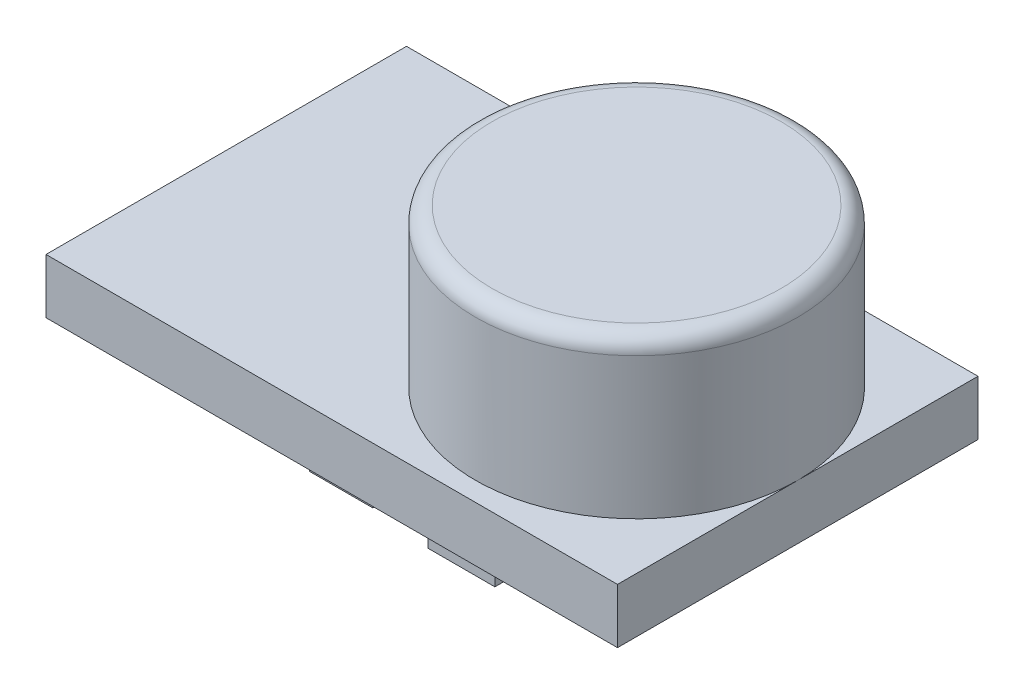
from build123d import *

# Parameters (mm, degrees)
SKETCH1_W           = 17.2
SKETCH1_H           = 10.85
BOSS_EXTRUDE1_DEPTH = 1.65
SKETCH2_R           = 4.85
BOSS_EXTRUDE2_DEPTH = 4.75
FILLET1_R           = 0.5
SKETCH3_W           = 1.359488803
SKETCH3_H           = 3.031292602
SKETCH3_W_2         = 1.800404091
SKETCH3_H_2         = 0.955316456
SKETCH3_W_3         = 0.863459105
SKETCH3_H_3         = 1.72691821
SKETCH3_W_4         = 0.918573516
SKETCH3_W_5         = 1.910632913
SKETCH3_H_4         = 0.936944986
SKETCH3_H_5         = 0.973687927
SKETCH3_W_6         = 2.020861734
SKETCH3_W_7         = 0.936944986
SKETCH3_H_6         = 2.112719086
SKETCH3_W_8         = 1.855518501
SKETCH3_H_7         = 0.992059397
BOSS_EXTRUDE3_DEPTH = 1


with BuildPart() as part:
    # Sketch1 → Boss-Extrude1 (new body)
    with BuildSketch(Plane(origin=(0, 0, 0), x_dir=(1, 0, 0), z_dir=(0, 1, 0))):
        Rectangle(SKETCH1_W, SKETCH1_H)
    extrude(amount=BOSS_EXTRUDE1_DEPTH)

    # Sketch2 → Boss-Extrude2 (add)
    with BuildSketch(Plane(origin=(0, 1.65, 0), x_dir=(1, 0, 0), z_dir=(0, 1, 0))):
        with Locations((3.75, 0)):
            Circle(SKETCH2_R)
    extrude(amount=BOSS_EXTRUDE2_DEPTH)

    # Fillet1
    fillet1_edges = [part.edges().sort_by_distance(p)[0] for p in [
        (-1.1, 6.4, 0),
    ]]
    fillet(fillet1_edges, radius=FILLET1_R)

    # Sketch3 → Boss-Extrude3 (add)
    with BuildSketch(Plane.XZ):
        with Locations((-0.679744402, -0.192900438)):
            Rectangle(SKETCH3_W, SKETCH3_H)
        with Locations((-0.624629991, -2.755720547)):
            Rectangle(SKETCH3_W_2, SKETCH3_H_2)
        with Locations((-3.554879506, 0.055114411)):
            Rectangle(SKETCH3_W_3, SKETCH3_H_3)
        with Locations((-4.997039925, 0.055114411)):
            Rectangle(SKETCH3_W_4, SKETCH3_H_3)
        with Locations((-0.679744402, 3.995794793)):
            Rectangle(SKETCH3_W_5, SKETCH3_H_4)
        with Locations((-0.679744402, 2.746534812)):
            Rectangle(SKETCH3_W_5, SKETCH3_H_5)
        with Locations((3.159892894, 4.197880967)):
            Rectangle(SKETCH3_W_6, SKETCH3_H_5)
        with Locations((2.103533351, 1.46053189)):
            Rectangle(SKETCH3_W_7, SKETCH3_H_6)
        with Locations((3.398722008, 1.46053189)):
            Rectangle(SKETCH3_W_4, SKETCH3_H_6)
        with Locations((3.077221278, -1.414603215)):
            Rectangle(SKETCH3_W_8, SKETCH3_H_7)
    extrude(amount=BOSS_EXTRUDE3_DEPTH)


solid = part.part
